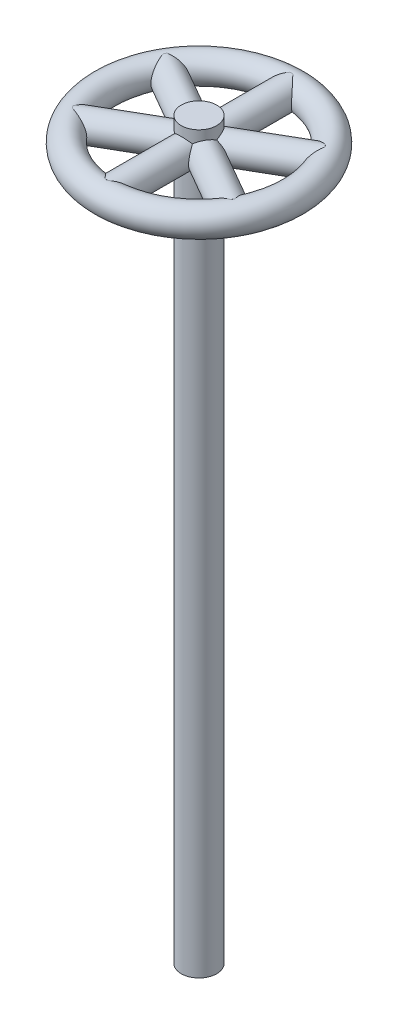
from build123d import *
from build123d.topology import SkipClean

# Parameters (mm, degrees)
SKETCH_1_R               = 7.5
EXTRUDE_1_DEPTH          = 250
SKETCH_2_R               = 7.5
EXTRUDE_2_DEPTH          = 50
SWEEP_1_PROFILE_R        = 6
SWEEP_1_PROFILE_R_2      = 5
SKETCH_16_R              = 6
EXTRUDE_3_DEPTH          = 39
PATTERN_CIRCULAR_1_COUNT = 3
SKETCH_17_R              = 7.5
EXTRUDE_4_DEPTH          = 310


with BuildPart() as part:
    # 草图1 → 凸台-拉伸1 (new body)
    with BuildSketch(Plane(origin=(0, 0, 0), x_dir=(1, 0, 0), z_dir=(0, 1, 0))):
        with Locations(Location((0, 0, 0), (0, 0, 270))):
            Circle(SKETCH_1_R)
    extrude(amount=EXTRUDE_1_DEPTH)

    # 草图2 → 凸台-拉伸2 (add)
    with BuildSketch(Plane(origin=(0, 250, 0), x_dir=(1, 0, 0), z_dir=(0, 1, 0))):
        with Locations(Location((0, 0, 0), (0, 0, 270))):
            Circle(SKETCH_2_R)
    extrude(amount=EXTRUDE_2_DEPTH)



with BuildPart() as body_2:
    # 扫描-薄件1: sweep along a path in 草图3
    with BuildLine(Plane(origin=(0, 300, 0), x_dir=(1, 0, 0), z_dir=(0, 1, 0))) as sweep_1_path:
        CenterArc((0, 0), 39.600864497, 0, 360)
    # 扫描-薄件1 profile (on start of the path) → 扫描-薄件1 (sweep)
    with BuildSketch(Plane(origin=(39.600864497, 300, 0), x_dir=(-1, 0, 0), z_dir=(0, 0, -1))):
        Circle(SWEEP_1_PROFILE_R)
        Circle(SWEEP_1_PROFILE_R_2, mode=Mode.SUBTRACT)
    sweep(path=sweep_1_path.line)


with BuildPart() as part_1:
    with SkipClean():  # the faces are left unmerged after this step: merging them gives an invalid solid
        add(part.part)

        add(body_2.part)  # 凸台-拉伸3 merges body 2
        # 草图16 → 凸台-拉伸3 (add, symmetric)
        with BuildSketch(Plane.XY):
            with Locations(Location((0, 300, 0), (0, 0, 95.703719099))):
                Circle(SKETCH_16_R)
        extrude_3 = extrude(amount=EXTRUDE_3_DEPTH, both=True)

    # 阵列(圆周)1: 凸台-拉伸3 ×3 about axis
    with SkipClean():  # the faces are left unmerged after this step: merging them gives an invalid solid
        pattern_circular_1_axis = Axis((0, 0, 0), (0, 1, 0))
        for i in range(1, PATTERN_CIRCULAR_1_COUNT):
            add(extrude_3.rotate(pattern_circular_1_axis, i * 360 / PATTERN_CIRCULAR_1_COUNT))

    # 草图17 → 凸台-拉伸4 (add)
    with SkipClean():  # the faces are left unmerged after this step: merging them gives an invalid solid
        with BuildSketch(Plane.XZ):
            with Locations(Location((0, 0, 0), (0, 0, 240.000000144))):
                Circle(SKETCH_17_R)
        extrude(amount=-EXTRUDE_4_DEPTH)


solid = part_1.part
